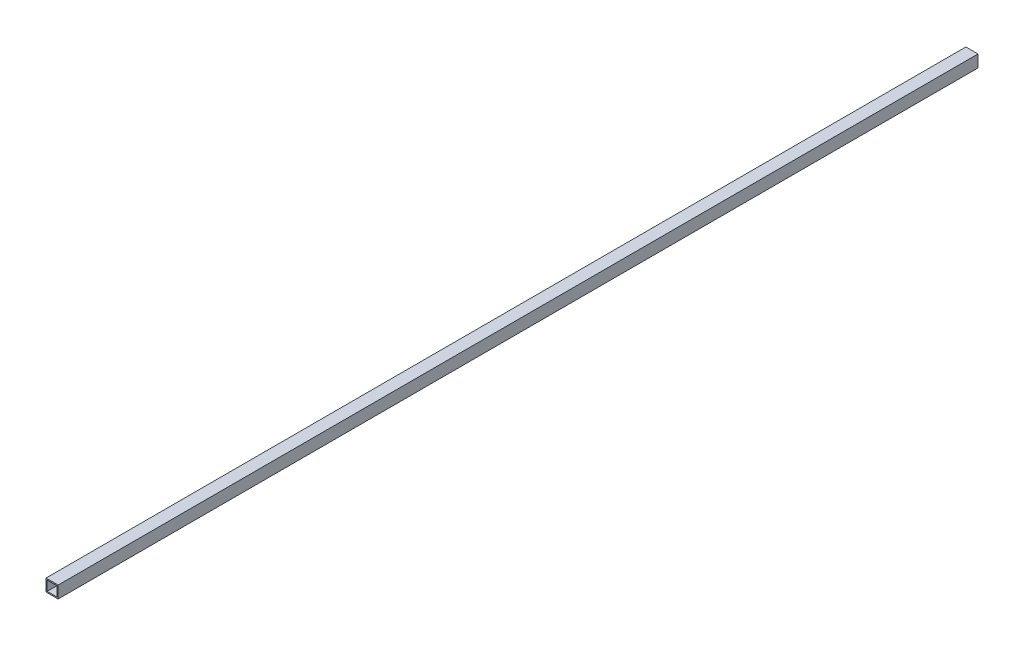
from build123d import *

# Parameters (mm, degrees)
SKETCH1_W           = 10.3
SKETCH1_H           = 10.3
SKETCH1_W_2         = 8.3
SKETCH1_H_2         = 8.3
BOSS_EXTRUDE1_DEPTH = 781


with BuildPart() as part:
    # Sketch1 → Boss-Extrude1 (new body)
    with BuildSketch(Plane.XY):
        Rectangle(SKETCH1_W, SKETCH1_H)
        Rectangle(SKETCH1_W_2, SKETCH1_H_2, mode=Mode.SUBTRACT)
    extrude(amount=BOSS_EXTRUDE1_DEPTH)


solid = part.part
